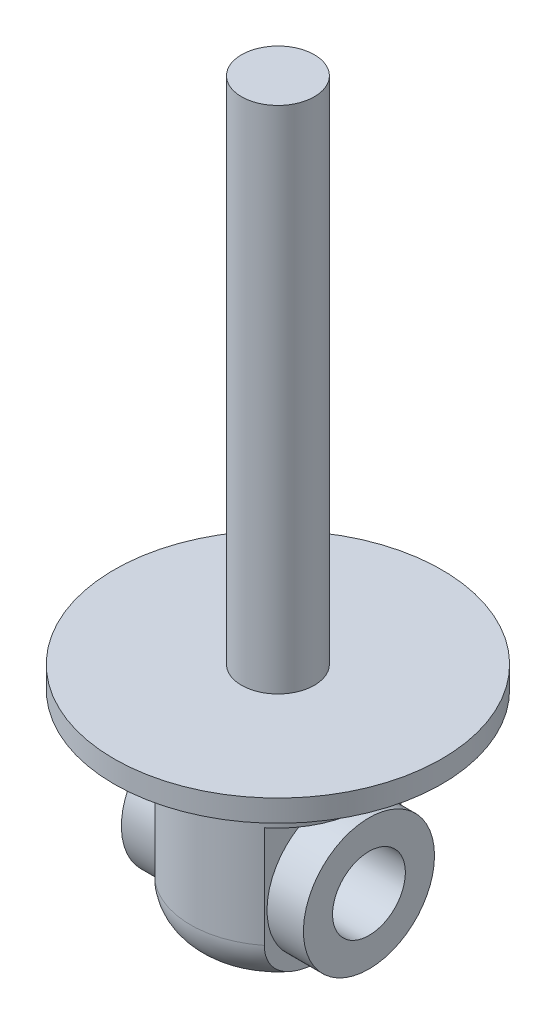
from build123d import *

# Parameters (mm, degrees)
SKETCH1_R               = 22.5
BOSS_EXTRUDE1_DEPTH     = 3
SKETCH2_R               = 5
BOSS_EXTRUDE2_DEPTH     = 70
SKETCH3_R               = 12
BOSS_EXTRUDE3_DEPTH     = 28
FILLET1_R               = 6
CUT_EXTRUDE1_DEPTH      = 80.633535649
CUT_EXTRUDE1_DEPTH_BACK = 80.633535649
SKETCH4_W               = 19.57
SKETCH4_H               = 20
CUT_EXTRUDE2_DEPTH      = 83.068568892
CUT_EXTRUDE2_DEPTH_BACK = 83.068568892
SKETCH6_R               = 5
SKETCH8_R               = 9
SKETCH8_R_2             = 5
BOSS_EXTRUDE4_DEPTH     = 12.5


with BuildPart() as part:
    # Sketch1 → Boss-Extrude1 (new body)
    with BuildSketch(Plane(origin=(0, 0, 0), x_dir=(1, 0, 0), z_dir=(0, 1, 0))):
        with Locations(Location((0, 0, 0), (0, 0, 270))):
            Circle(SKETCH1_R)
    extrude(amount=BOSS_EXTRUDE1_DEPTH)

    # Sketch2 → Boss-Extrude2 (add)
    with BuildSketch(Plane(origin=(0, 3, 0), x_dir=(1, 0, 0), z_dir=(0, 1, 0))):
        with Locations(Location((0, 0, 0), (0, 0, 270))):
            Circle(SKETCH2_R)
    extrude(amount=BOSS_EXTRUDE2_DEPTH)

    # Sketch3 → Boss-Extrude3 (add)
    with BuildSketch(Plane.XZ):
        with Locations(Location((0, 0, 0), (0, 0, 270))):
            Circle(SKETCH3_R)
    extrude(amount=BOSS_EXTRUDE3_DEPTH)

    # Fillet1
    fillet1_edges = [part.edges().sort_by_distance(p)[0] for p in [
        (0, -28, 12),
    ]]
    fillet(fillet1_edges, radius=FILLET1_R)

    # Sketch4 → Cut-Extrude1 (cut, two sides: drawn at the far end of the back side and taken through both)
    with BuildSketch(Plane.XY.offset(-CUT_EXTRUDE1_DEPTH_BACK)):
        with Locations((17.285, -18)):
            Rectangle(SKETCH4_W, SKETCH4_H)
        with Locations((-17.285, -18)):
            Rectangle(SKETCH4_W, SKETCH4_H)
    extrude(amount=CUT_EXTRUDE1_DEPTH + CUT_EXTRUDE1_DEPTH_BACK, mode=Mode.SUBTRACT)

    # Sketch6 → Cut-Extrude2 (cut, two sides: drawn at the far end of the back side and taken through both)
    with BuildSketch(Plane(origin=(7.5, 0, 0), x_dir=(0, 0, -1), z_dir=(1, 0, 0)).offset(-CUT_EXTRUDE2_DEPTH_BACK)):
        with Locations(Location((0, -18, 0), (0, 0, 90))):
            Circle(SKETCH6_R)
    extrude(amount=CUT_EXTRUDE2_DEPTH + CUT_EXTRUDE2_DEPTH_BACK, mode=Mode.SUBTRACT)

    # Sketch8 → Boss-Extrude4 (add, symmetric)
    with BuildSketch(Plane(origin=(0, 0, 0), x_dir=(0, 0, -1), z_dir=(1, 0, 0))):
        with Locations(Location((0, -18, 0), (0, 0, 270))):
            Circle(SKETCH8_R)
        with Locations(Location((0, -18, 0), (0, 0, 90))):
            Circle(SKETCH8_R_2, mode=Mode.SUBTRACT)
    extrude(amount=BOSS_EXTRUDE4_DEPTH, both=True)


solid = part.part
